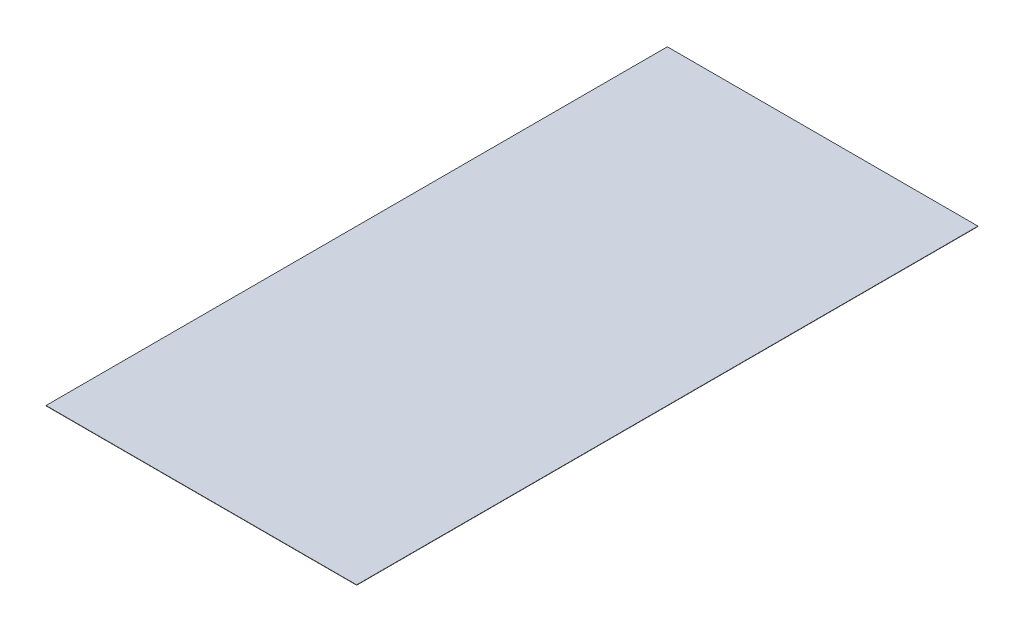
from build123d import *

# Parameters (mm, degrees)
SKETCH1_W           = 1219.2
SKETCH1_H           = 2438.4
BOSS_EXTRUDE1_DEPTH = 1.24


with BuildPart() as part:
    # Sketch1 → Boss-Extrude1 (new body)
    with BuildSketch(Plane(origin=(0, 0, 0), x_dir=(1, 0, 0), z_dir=(0, 1, 0))):
        Rectangle(SKETCH1_W, SKETCH1_H)
    extrude(amount=BOSS_EXTRUDE1_DEPTH)


solid = part.part
